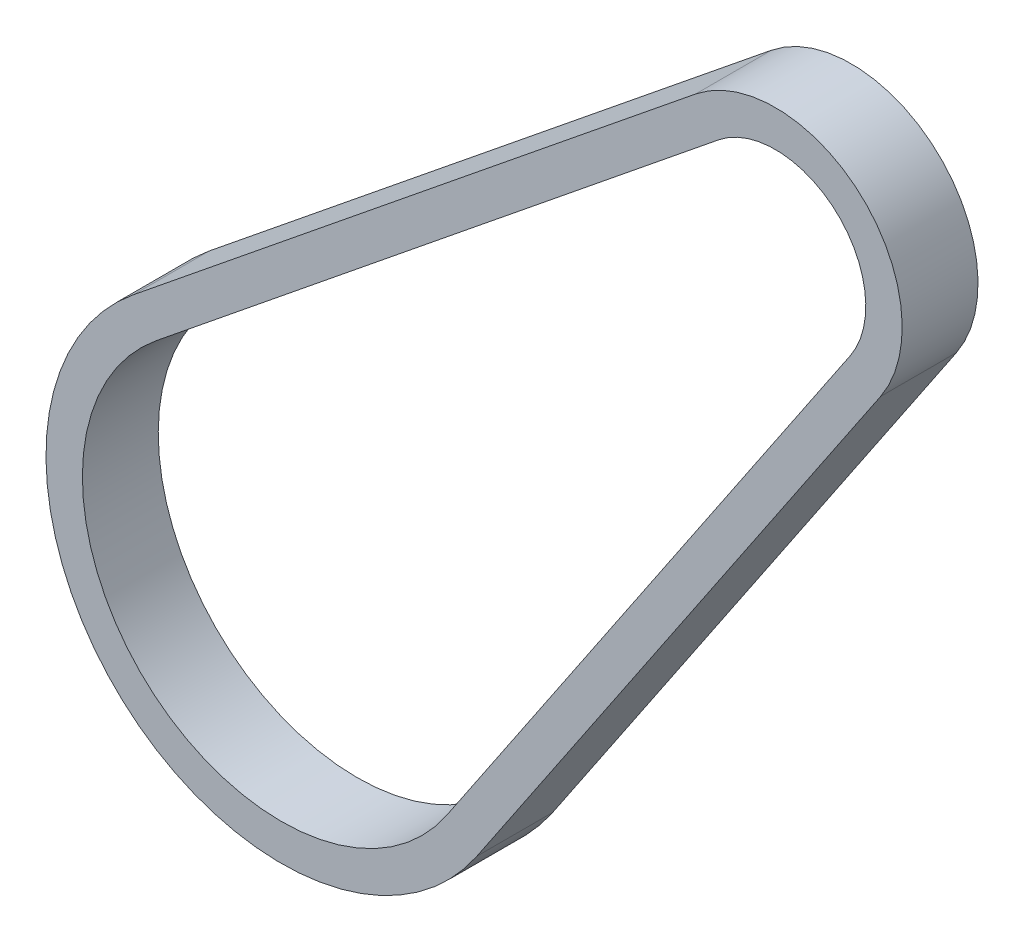
from build123d import *

# Parameters (mm, degrees)
EXTRUDE_THIN1_DEPTH = 5


with BuildPart() as part:
    # Sketch2 → Extrude-Thin1 (new body)
    with BuildSketch(Plane.XY):
        with BuildLine():
            Line((-9.765582908, 12.067570387), (27.300303168, 42.062836373))
            ThreePointArc((27.300303168, 42.062836373), (38.207290749, 41.73003182), (39.498257332, 30.894601868))
            Line((39.498257332, 30.894601868), (12.879835913, -8.666180903))
            ThreePointArc((12.879835913, -8.666180903), (-10.483165246, -11.449721001), (-9.765582908, 12.067570387))
        make_face()
        with BuildLine():
            Line((-8.255824972, 10.201925465), (28.810061105, 40.197191451))
            ThreePointArc((28.810061105, 40.197191451), (36.586594671, 39.959906338), (37.507036258, 32.234392387))
            Line((37.507036258, 32.234392387), (10.888614839, -7.326390384))
            ThreePointArc((10.888614839, -7.326390384), (-8.862469167, -9.67959552), (-8.255824972, 10.201925465))
        make_face(mode=Mode.SUBTRACT)
    extrude(amount=-EXTRUDE_THIN1_DEPTH)


solid = part.part
